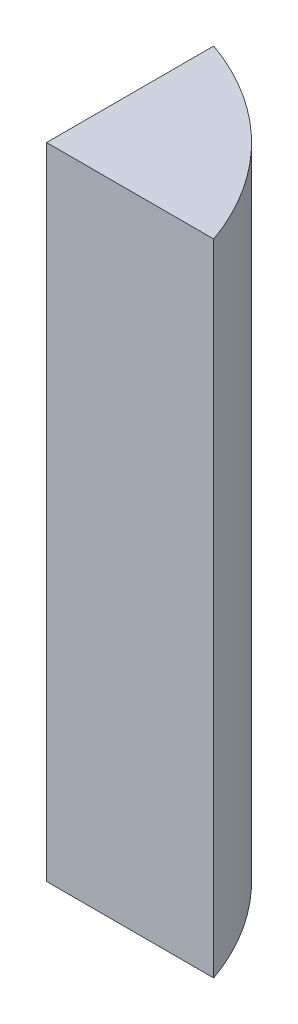
from build123d import *

# Parameters (mm, degrees)
EXTRUDE_1_DEPTH = 140


with BuildPart() as part:
    # 草图1 → 凸台-拉伸1 (new body)
    with BuildSketch(Plane(origin=(0, 0, 0), x_dir=(1, 0, 0), z_dir=(0, 1, 0))):
        with BuildLine():
            Line((20, 56.568542495), (20, 20))
            Line((20, 20), (56.568542495, 20))
            ThreePointArc((56.568542495, 20), (42.426406871, 42.426406871), (20, 56.568542495))
        make_face()
    extrude(amount=EXTRUDE_1_DEPTH)


solid = part.part
